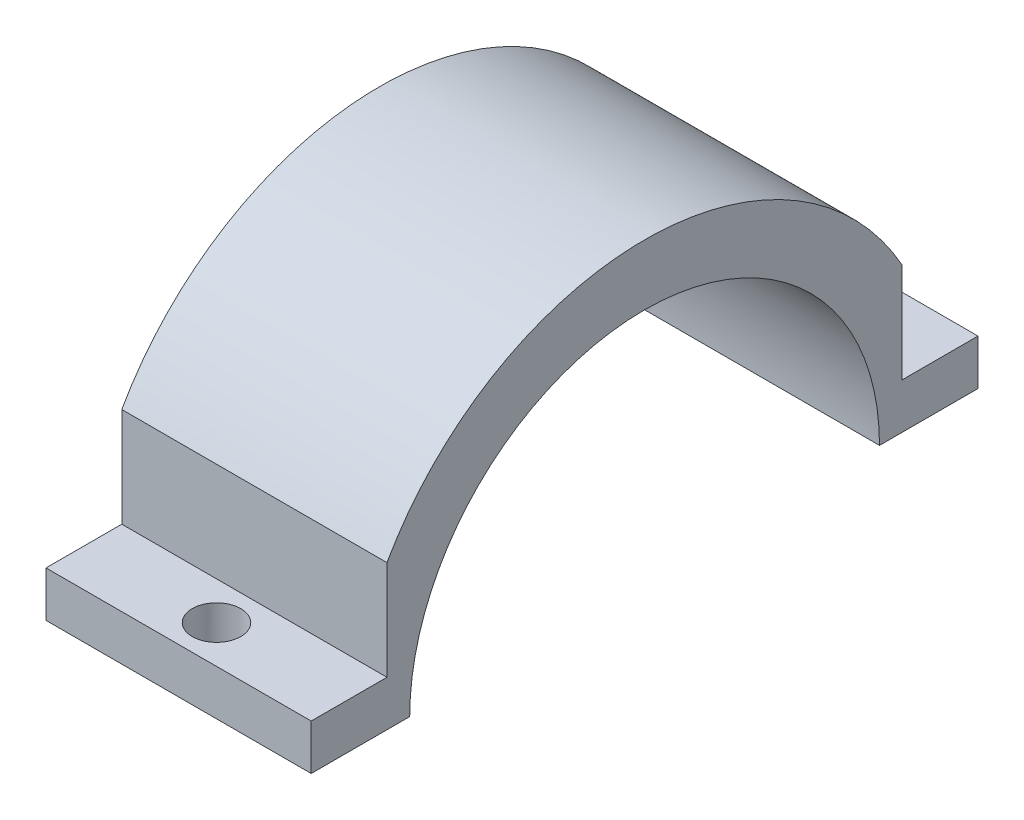
from build123d import *

# Parameters (mm, degrees)
SKETCH_1_W               = 17
SKETCH_1_H               = 40
EXTRUDE_1_DEPTH          = 50
SKETCH_2_W               = 17
SKETCH_2_H               = 1
CUT_EXTRUDE_1_DEPTH      = 67.2495283
SKETCH_4_W               = 0.5
SKETCH_4_H               = 39
EXTRUDE_2_DEPTH          = 50
SKETCH_5_R               = 15.5
CUT_EXTRUDE_2_DEPTH      = 17.5
CUT_EXTRUDE_3_DEPTH      = 17.5
CUT_EXTRUDE_4_DEPTH      = 3
CUT_EXTRUDE_START        = -64
CUT_EXTRUDE_7_DEPTH      = 64
SKETCH_9_W               = 5
SKETCH_9_H               = 3
EXTRUDE_3_DEPTH          = 17.5
CUT_EXTRUDE_8_DEPTH      = 54.087192429
CUT_EXTRUDE_8_DEPTH_BACK = 54.087192429
CUT_EXTRUDE_9_DEPTH      = 64


with BuildPart() as part:
    # 草图1 → 凸台-拉伸1 (new body)
    with BuildSketch(Plane(origin=(0, 0, 0), x_dir=(1, 0, 0), z_dir=(0, 1, 0))):
        with Locations((8.5, -20)):
            Rectangle(SKETCH_1_W, SKETCH_1_H)
    extrude(amount=EXTRUDE_1_DEPTH)

    # 草图2 → 切除-拉伸1 (cut, through all)
    with BuildSketch(Plane.XZ):
        with Locations((8.5, 39.5)):
            Rectangle(SKETCH_2_W, SKETCH_2_H)
    extrude(amount=-CUT_EXTRUDE_1_DEPTH, mode=Mode.SUBTRACT)

    # 草图4 → 凸台-拉伸2 (add)
    with BuildSketch(Plane.XZ):
        with Locations((-0.25, 19.5)):
            Rectangle(SKETCH_4_W, SKETCH_4_H)
    extrude(amount=-EXTRUDE_2_DEPTH)

    # 草图5 → 切除-拉伸2 (cut)
    with BuildSketch(Plane(origin=(17, 0, 0), x_dir=(0, 0, -1), z_dir=(1, 0, 0))):
        with Locations((-22, 4.5)):
            Circle(SKETCH_5_R)
    extrude(amount=-CUT_EXTRUDE_2_DEPTH, mode=Mode.SUBTRACT)

    # 草图6 → 切除-拉伸3 (cut)
    with BuildSketch(Plane(origin=(17, 0, 0), x_dir=(0, 0, -1), z_dir=(1, 0, 0))):
        Polygon((0, 3), (0, 24), (0, 50), (-39, 50), (-39, 24), (-22, 24), (-5, 24), (-5, 3), align=None)
    extrude(amount=-CUT_EXTRUDE_3_DEPTH, mode=Mode.SUBTRACT)

    # 草图7 → 切除-拉伸4 (cut)
    with BuildSketch(Plane(origin=(0, 3, 0), x_dir=(1, 0, 0), z_dir=(0, 1, 0))):
        with BuildLine():
            ThreePointArc((8.25, -0.9), (6.65, -2.5), (8.25, -4.1))
            Line((8.25, -4.1), (8.25, -0.9))
        make_face()
        with BuildLine():
            Line((8.25, -0.9), (8.25, -4.1))
            ThreePointArc((8.25, -4.1), (9.38137085, -3.63137085), (9.85, -2.5))
            ThreePointArc((9.85, -2.5), (9.38137085, -1.36862915), (8.25, -0.9))
        make_face()
    extrude(amount=-CUT_EXTRUDE_4_DEPTH, mode=Mode.SUBTRACT)

    # 草图8 → 切除-拉伸7 (cut)
    with BuildSketch(Plane.ZY.offset(0.5).offset(CUT_EXTRUDE_START)):
        with BuildLine():
            Line((5, 3), (5, 4.5))
            Line((5, 4.5), (-8.613521725, 4.5))
            Line((-8.613521725, 4.5), (17.256515703, -28.446816898))
            Line((17.256515703, -28.446816898), (39, 0))
            Line((39, 0), (36.832396974, 0))
            ThreePointArc((36.832396974, 0), (22, -11), (7.167603026, 0))
            Line((7.167603026, 0), (0, 0))
            Line((0, 0), (0, 3))
            Line((0, 3), (5, 3))
        make_face()
        with BuildLine():
            ThreePointArc((7.167603026, 0), (6.667809141, 2.225373998), (6.5, 4.5))
            Line((6.5, 4.5), (5, 4.5))
            Line((5, 4.5), (5, 3))
            Line((5, 3), (0, 3))
            Line((0, 3), (0, 0))
            Line((0, 0), (7.167603026, 0))
        make_face()
        with BuildLine():
            Line((37.5, 4.5), (22, 4.5))
            Line((22, 4.5), (6.5, 4.5))
            ThreePointArc((6.5, 4.5), (6.667809141, 2.225373998), (7.167603026, 0))
            ThreePointArc((7.167603026, 0), (22, -11), (36.832396974, 0))
            ThreePointArc((36.832396974, 0), (37.332190859, 2.225373998), (37.5, 4.5))
        make_face()
        with BuildLine():
            Line((6.5, 4.5), (22, 4.5))
            Line((22, 4.5), (37.5, 4.5))
            ThreePointArc((37.5, 4.5), (22, 20), (6.5, 4.5))
        make_face()
        with BuildLine():
            Line((39, 4.5), (37.5, 4.5))
            ThreePointArc((37.5, 4.5), (37.332190859, 2.225373998), (36.832396974, 0))
            Line((36.832396974, 0), (39, 0))
            Line((39, 0), (39, 4.5))
        make_face()
    extrude(amount=CUT_EXTRUDE_7_DEPTH, mode=Mode.SUBTRACT)

    # 草图9 → 凸台-拉伸3 (add)
    with BuildSketch(Plane.ZY.offset(0.5)):
        with Locations((2.5, 6)):
            Rectangle(SKETCH_9_W, SKETCH_9_H)
        with Locations((41.5, 6)):
            Rectangle(SKETCH_9_W, SKETCH_9_H)
    extrude(amount=-EXTRUDE_3_DEPTH)

    # 草图10 → 切除-拉伸8 (cut, two sides: drawn at the far end of the back side and taken through both)
    with BuildSketch(Plane.ZY.offset(0.5).offset(-CUT_EXTRUDE_8_DEPTH_BACK)):
        with BuildLine():
            Line((5, 24), (5, 14.052486587))
            ThreePointArc((5, 14.052486587), (12.151738439, 21.330381583), (22, 24))
            Line((22, 24), (5, 24))
        make_face()
        with BuildLine():
            Line((39, 24), (22, 24))
            ThreePointArc((22, 24), (31.848261561, 21.330381583), (39, 14.052486587))
            Line((39, 14.052486587), (39, 24))
        make_face()
    extrude(amount=CUT_EXTRUDE_8_DEPTH + CUT_EXTRUDE_8_DEPTH_BACK, mode=Mode.SUBTRACT)

    # 草图11 → 切除-拉伸9 (cut)
    with BuildSketch(Plane(origin=(0, 7.5, 0), x_dir=(1, 0, 0), z_dir=(0, 1, 0))):
        with BuildLine():
            ThreePointArc((8.25, -0.9), (6.65, -2.5), (8.25, -4.1))
            Line((8.25, -4.1), (8.25, -0.9))
        make_face()
        with BuildLine():
            Line((8.25, -0.9), (8.25, -4.1))
            ThreePointArc((8.25, -4.1), (9.38137085, -3.63137085), (9.85, -2.5))
            ThreePointArc((9.85, -2.5), (9.38137085, -1.36862915), (8.25, -0.9))
        make_face()
        with BuildLine():
            ThreePointArc((9.85, -41.5), (9.38137085, -40.36862915), (8.25, -39.9))
            Line((8.25, -39.9), (8.25, -43.1))
            ThreePointArc((8.25, -43.1), (9.38137085, -42.63137085), (9.85, -41.5))
        make_face()
        with BuildLine():
            Line((8.25, -43.1), (8.25, -39.9))
            ThreePointArc((8.25, -39.9), (6.65, -41.5), (8.25, -43.1))
        make_face()
    extrude(amount=-CUT_EXTRUDE_9_DEPTH, mode=Mode.SUBTRACT)


solid = part.part
